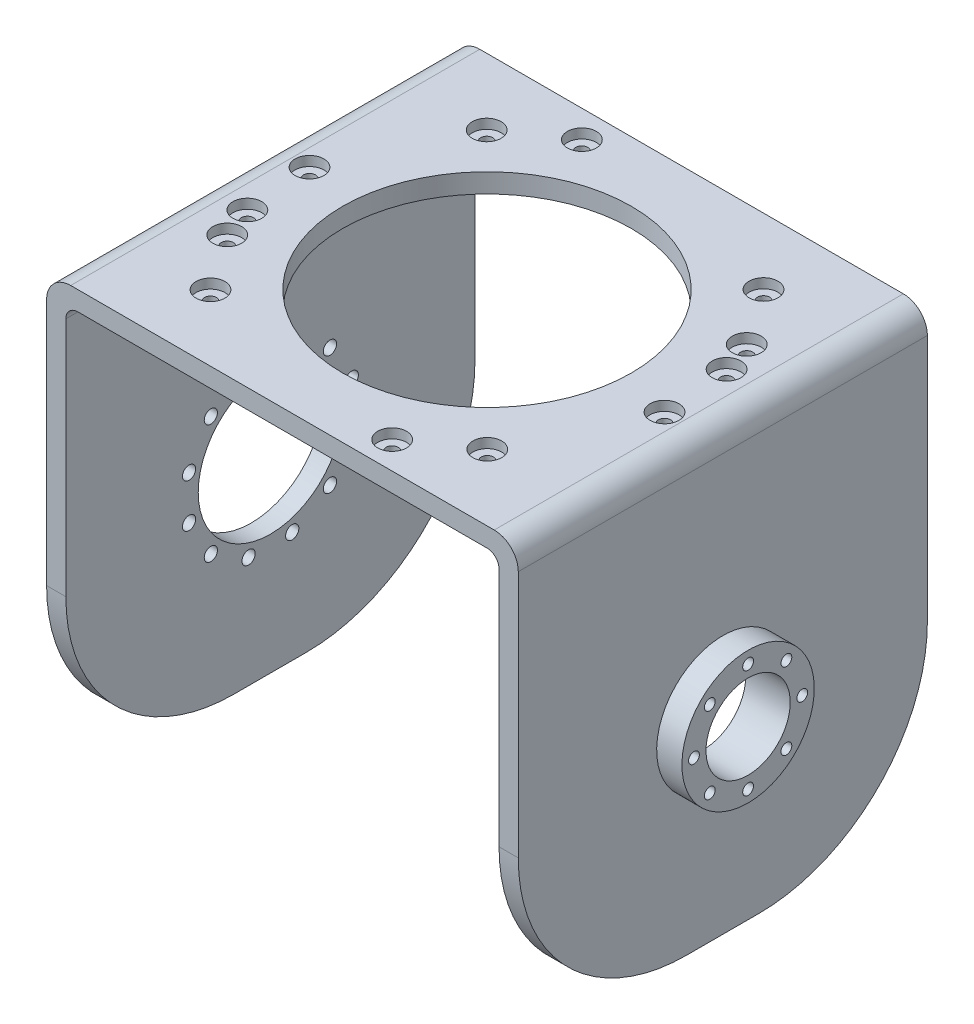
from build123d import *

# Parameters (mm, degrees)
EXTRUDE_1_DEPTH          = 170
SKETCH_2_R               = 60
CUT_EXTRUDE_1_DEPTH      = 180
CUT_EXTRUDE_2_DEPTH      = 313.955268369
CUT_EXTRUDE_2_DEPTH_BACK = 313.955268369
SKETCH_3_R               = 17.5
FILLET_1_R               = 70
FILLET_2_R               = 5
FILLET_3_R               = 10
SKETCH_6_R               = 30
CUT_EXTRUDE_6_DEPTH      = 39
SKETCH_10_R              = 2.5
CUT_EXTRUDE_10_DEPTH     = 10
CUT_EXTRUDE_START        = -4
SKETCH_11_R              = 6
SKETCH_11_R_2            = 2.5
CUT_EXTRUDE_11_DEPTH     = 4
SKETCH_12_R              = 2.75
CUT_EXTRUDE_12_DEPTH     = 10
EXTRUDE_START            = 10.5
SKETCH_14_R              = 27.5
SKETCH_14_R_2            = 17.5
EXTRUDE_2_DEPTH          = 10.5
SKETCH_13_R              = 2.25
CUT_EXTRUDE_13_DEPTH     = 15


with BuildPart() as part:
    # 草图1 → 凸台-拉伸1 (new body)
    with BuildSketch(Plane.XY):
        Polygon((-180, 0), (0, 0), (0, -175), (8, -175), (8, 8), (-180, 8), (-188, 8), (-188, -175), (-180, -175), align=None)
    extrude(amount=EXTRUDE_1_DEPTH)

    # 草图2 → 切除-拉伸1 (cut)
    with BuildSketch(Plane(origin=(0, 8, 0), x_dir=(1, 0, 0), z_dir=(0, 1, 0))):
        with Locations(Location((-90, -85, 0), (0, 0, 180))):
            Circle(SKETCH_2_R)
    extrude(amount=-CUT_EXTRUDE_1_DEPTH, mode=Mode.SUBTRACT)

    # 草图3 → 切除-拉伸2 (cut, two sides: drawn at the far end of the back side and taken through both)
    with BuildSketch(Plane(origin=(8, 0, 0), x_dir=(0, 0, -1), z_dir=(1, 0, 0)).offset(-CUT_EXTRUDE_2_DEPTH_BACK)):
        with Locations(Location((-85, -95, 0), (0, 0, 90))):
            Circle(SKETCH_3_R)
    extrude(amount=CUT_EXTRUDE_2_DEPTH + CUT_EXTRUDE_2_DEPTH_BACK, mode=Mode.SUBTRACT)

    # 圆角1
    fillet_1_edges = [part.edges().sort_by_distance(p)[0] for p in [
        (4, -175, 0),
        (4, -175, 170),
        (-184, -175, 170),
        (-184, -175, 0),
    ]]
    fillet(fillet_1_edges, radius=FILLET_1_R)

    # 圆角2
    fillet_2_edges = [part.edges().sort_by_distance(p)[0] for p in [
        (0, 0, 85),
        (-180, 0, 85),
    ]]
    fillet(fillet_2_edges, radius=FILLET_2_R)

    # 圆角3
    fillet_3_edges = [part.edges().sort_by_distance(p)[0] for p in [
        (-188, 8, 85),
        (8, 8, 85),
    ]]
    fillet(fillet_3_edges, radius=FILLET_3_R)

    # 草图6 → 切除-拉伸6 (cut)
    with BuildSketch(Plane.ZY.offset(188)):
        with Locations(Location((85, -95, 0), (0, 0, 270))):
            Circle(SKETCH_6_R)
    extrude(amount=-CUT_EXTRUDE_6_DEPTH, mode=Mode.SUBTRACT)

    # 草图10 → 切除-拉伸10 (cut)
    with BuildSketch(Plane.XZ):
        with Locations(Location((-55.742253069, 158.674753309, 0), (0, 0, 270))):
            Circle(SKETCH_10_R)
        with Locations(Location((-32.485217492, 142.390001682, 0), (0, 0, 270))):
            Circle(SKETCH_10_R)
        with Locations(Location((-9.066918551, 92.169297536, 0), (0, 0, 270))):
            Circle(SKETCH_10_R)
        with Locations(Location((-11.541409366, 63.885738097, 0), (0, 0, 270))):
            Circle(SKETCH_10_R)
        with Locations(Location((-16.325246691, 50.742253069, 0), (0, 0, 270))):
            Circle(SKETCH_10_R)
        with Locations(Location((-32.609998318, 27.485217492, 0), (0, 0, 270))):
            Circle(SKETCH_10_R)
        with Locations(Location((-124.257746931, 11.325246691, 0), (0, 0, 270))):
            Circle(SKETCH_10_R)
        with Locations(Location((-147.514782508, 27.609998318, 0), (0, 0, 270))):
            Circle(SKETCH_10_R)
        with Locations(Location((-170.933081449, 77.830702464, 0), (0, 0, 270))):
            Circle(SKETCH_10_R)
        with Locations(Location((-168.458590634, 106.114261903, 0), (0, 0, 270))):
            Circle(SKETCH_10_R)
        with Locations(Location((-163.674753309, 119.257746931, 0), (0, 0, 270))):
            Circle(SKETCH_10_R)
        with Locations(Location((-147.390001682, 142.514782508, 0), (0, 0, 270))):
            Circle(SKETCH_10_R)
    extrude(amount=-CUT_EXTRUDE_10_DEPTH, mode=Mode.SUBTRACT)

    # 草图11 → 切除-拉伸11 (cut)
    # profile 1 of 12: a face of its own
    with BuildSketch(Plane(origin=(0, 8, 0), x_dir=(1, 0, 0), z_dir=(0, 1, 0)).offset(CUT_EXTRUDE_START)):
        with Locations(Location((-32.485217492, -142.390001682, 0), (0, 0, 180))):
            Circle(SKETCH_11_R)
        with Locations(Location((-32.485217492, -142.390001682, 0), (0, 0, 90))):
            Circle(SKETCH_11_R_2, mode=Mode.SUBTRACT)
    # profile 2 of 12: a face of its own
    with BuildSketch(Plane(origin=(0, 8, 0), x_dir=(1, 0, 0), z_dir=(0, 1, 0)).offset(CUT_EXTRUDE_START)):
        with Locations(Location((-55.742253069, -158.674753309, 0), (0, 0, 180))):
            Circle(SKETCH_11_R)
        with Locations(Location((-55.742253069, -158.674753309, 0), (0, 0, 90))):
            Circle(SKETCH_11_R_2, mode=Mode.SUBTRACT)
    # profile 3 of 12: a face of its own
    with BuildSketch(Plane(origin=(0, 8, 0), x_dir=(1, 0, 0), z_dir=(0, 1, 0)).offset(CUT_EXTRUDE_START)):
        with Locations(Location((-147.390001682, -142.514782508, 0), (0, 0, 180))):
            Circle(SKETCH_11_R)
        with Locations(Location((-147.390001682, -142.514782508, 0), (0, 0, 90))):
            Circle(SKETCH_11_R_2, mode=Mode.SUBTRACT)
    # profile 4 of 12: a face of its own
    with BuildSketch(Plane(origin=(0, 8, 0), x_dir=(1, 0, 0), z_dir=(0, 1, 0)).offset(CUT_EXTRUDE_START)):
        with Locations(Location((-163.674753309, -119.257746931, 0), (0, 0, 180))):
            Circle(SKETCH_11_R)
        with Locations(Location((-163.674753309, -119.257746931, 0), (0, 0, 90))):
            Circle(SKETCH_11_R_2, mode=Mode.SUBTRACT)
    # profile 5 of 12: a face of its own
    with BuildSketch(Plane(origin=(0, 8, 0), x_dir=(1, 0, 0), z_dir=(0, 1, 0)).offset(CUT_EXTRUDE_START)):
        with Locations(Location((-168.458590634, -106.114261903, 0), (0, 0, 180))):
            Circle(SKETCH_11_R)
        with Locations(Location((-168.458590634, -106.114261903, 0), (0, 0, 90))):
            Circle(SKETCH_11_R_2, mode=Mode.SUBTRACT)
    # profile 6 of 12: a face of its own
    with BuildSketch(Plane(origin=(0, 8, 0), x_dir=(1, 0, 0), z_dir=(0, 1, 0)).offset(CUT_EXTRUDE_START)):
        with Locations(Location((-170.933081449, -77.830702464, 0), (0, 0, 180))):
            Circle(SKETCH_11_R)
        with Locations(Location((-170.933081449, -77.830702464, 0), (0, 0, 90))):
            Circle(SKETCH_11_R_2, mode=Mode.SUBTRACT)
    # profile 7 of 12: a face of its own
    with BuildSketch(Plane(origin=(0, 8, 0), x_dir=(1, 0, 0), z_dir=(0, 1, 0)).offset(CUT_EXTRUDE_START)):
        with Locations(Location((-147.514782508, -27.609998318, 0), (0, 0, 180))):
            Circle(SKETCH_11_R)
        with Locations(Location((-147.514782508, -27.609998318, 0), (0, 0, 90))):
            Circle(SKETCH_11_R_2, mode=Mode.SUBTRACT)
    # profile 8 of 12: a face of its own
    with BuildSketch(Plane(origin=(0, 8, 0), x_dir=(1, 0, 0), z_dir=(0, 1, 0)).offset(CUT_EXTRUDE_START)):
        with Locations(Location((-124.257746931, -11.325246691, 0), (0, 0, 180))):
            Circle(SKETCH_11_R)
        with Locations(Location((-124.257746931, -11.325246691, 0), (0, 0, 90))):
            Circle(SKETCH_11_R_2, mode=Mode.SUBTRACT)
    # profile 9 of 12: a face of its own
    with BuildSketch(Plane(origin=(0, 8, 0), x_dir=(1, 0, 0), z_dir=(0, 1, 0)).offset(CUT_EXTRUDE_START)):
        with Locations(Location((-32.609998318, -27.485217492, 0), (0, 0, 180))):
            Circle(SKETCH_11_R)
        with Locations(Location((-32.609998318, -27.485217492, 0), (0, 0, 90))):
            Circle(SKETCH_11_R_2, mode=Mode.SUBTRACT)
    # profile 10 of 12: a face of its own
    with BuildSketch(Plane(origin=(0, 8, 0), x_dir=(1, 0, 0), z_dir=(0, 1, 0)).offset(CUT_EXTRUDE_START)):
        with Locations(Location((-16.325246691, -50.742253069, 0), (0, 0, 180))):
            Circle(SKETCH_11_R)
        with Locations(Location((-16.325246691, -50.742253069, 0), (0, 0, 90))):
            Circle(SKETCH_11_R_2, mode=Mode.SUBTRACT)
    # profile 11 of 12: a face of its own
    with BuildSketch(Plane(origin=(0, 8, 0), x_dir=(1, 0, 0), z_dir=(0, 1, 0)).offset(CUT_EXTRUDE_START)):
        with Locations(Location((-11.541409366, -63.885738097, 0), (0, 0, 180))):
            Circle(SKETCH_11_R)
        with Locations(Location((-11.541409366, -63.885738097, 0), (0, 0, 90))):
            Circle(SKETCH_11_R_2, mode=Mode.SUBTRACT)
    # profile 12 of 12: a face of its own
    with BuildSketch(Plane(origin=(0, 8, 0), x_dir=(1, 0, 0), z_dir=(0, 1, 0)).offset(CUT_EXTRUDE_START)):
        with Locations(Location((-9.066918551, -92.169297536, 0), (0, 0, 180))):
            Circle(SKETCH_11_R)
        with Locations(Location((-9.066918551, -92.169297536, 0), (0, 0, 90))):
            Circle(SKETCH_11_R_2, mode=Mode.SUBTRACT)
    extrude(amount=CUT_EXTRUDE_11_DEPTH, mode=Mode.SUBTRACT)

    # 草图12 → 切除-拉伸12 (cut)
    with BuildSketch(Plane.ZY.offset(188)):
        with Locations(Location((94.058666579, -128.80740392, 0), (0, 0, 270))):
            Circle(SKETCH_12_R)
        with Locations(Location((75.941333421, -128.80740392, 0), (0, 0, 270))):
            Circle(SKETCH_12_R)
        with Locations(Location((60.251262658, -119.748737342, 0), (0, 0, 270))):
            Circle(SKETCH_12_R)
        with Locations(Location((51.19259608, -104.058666579, 0), (0, 0, 270))):
            Circle(SKETCH_12_R)
        with Locations(Location((51.19259608, -85.941333421, 0), (0, 0, 270))):
            Circle(SKETCH_12_R)
        with Locations(Location((60.251262658, -70.251262658, 0), (0, 0, 270))):
            Circle(SKETCH_12_R)
        with Locations(Location((75.941333421, -61.19259608, 0), (0, 0, 270))):
            Circle(SKETCH_12_R)
        with Locations(Location((94.058666579, -61.19259608, 0), (0, 0, 270))):
            Circle(SKETCH_12_R)
        with Locations(Location((109.748737342, -70.251262658, 0), (0, 0, 270))):
            Circle(SKETCH_12_R)
        with Locations(Location((118.80740392, -85.941333421, 0), (0, 0, 270))):
            Circle(SKETCH_12_R)
        with Locations(Location((118.80740392, -104.058666579, 0), (0, 0, 270))):
            Circle(SKETCH_12_R)
        with Locations(Location((109.748737342, -119.748737342, 0), (0, 0, 270))):
            Circle(SKETCH_12_R)
    extrude(amount=-CUT_EXTRUDE_12_DEPTH, mode=Mode.SUBTRACT)

    # 草图14 → 凸台-拉伸2 (add)
    with BuildSketch(Plane(origin=(8, 0, 0), x_dir=(0, 0, -1), z_dir=(1, 0, 0)).offset(EXTRUDE_START)):
        with Locations(Location((-85, -95, 0), (0, 0, 270))):
            Circle(SKETCH_14_R)
        with Locations(Location((-85, -95, 0), (0, 0, 90))):
            Circle(SKETCH_14_R_2, mode=Mode.SUBTRACT)
    extrude(amount=-EXTRUDE_2_DEPTH)

    # 草图13 → 切除-拉伸13 (cut, symmetric)
    with BuildSketch(Plane(origin=(8, 0, 0), x_dir=(0, 0, -1), z_dir=(1, 0, 0))):
        with Locations(Location((-85, -72.5, 0), (0, 0, 90))):
            Circle(SKETCH_13_R)
        with Locations(Location((-69.090097423, -79.090097423, 0), (0, 0, 90))):
            Circle(SKETCH_13_R)
        with Locations(Location((-62.5, -95, 0), (0, 0, 90))):
            Circle(SKETCH_13_R)
        with Locations(Location((-69.090097423, -110.909902577, 0), (0, 0, 90))):
            Circle(SKETCH_13_R)
        with Locations(Location((-85, -117.5, 0), (0, 0, 90))):
            Circle(SKETCH_13_R)
        with Locations(Location((-100.909902577, -110.909902577, 0), (0, 0, 90))):
            Circle(SKETCH_13_R)
        with Locations(Location((-107.5, -95, 0), (0, 0, 90))):
            Circle(SKETCH_13_R)
        with Locations(Location((-100.909902577, -79.090097423, 0), (0, 0, 90))):
            Circle(SKETCH_13_R)
    extrude(amount=CUT_EXTRUDE_13_DEPTH, both=True, mode=Mode.SUBTRACT)


solid = part.part
